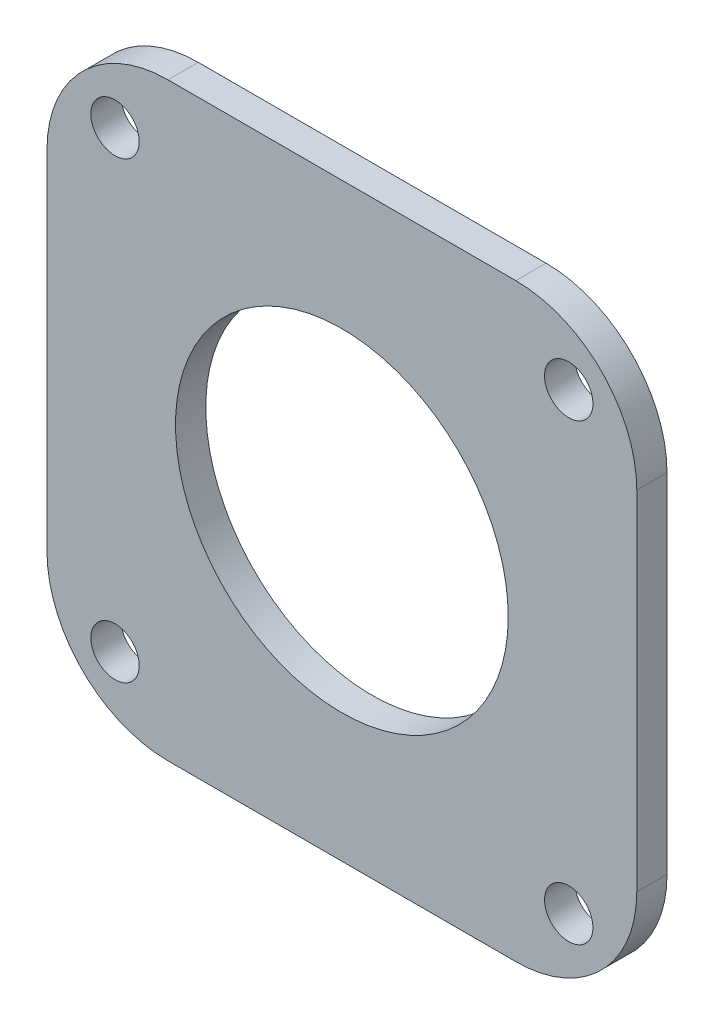
from build123d import *

# Parameters (mm, degrees)
SKETCH_1_R          = 1.6
SKETCH_1_R_2        = 5.5
EXTRUDE_2_DEPTH     = 2
FILLET_6_R          = 8
FILLET_7_R          = 8
FILLET_8_R          = 8
FILLET_9_R          = 8
SKETCH_2_R          = 11
CUT_EXTRUDE_1_DEPTH = 10


with BuildPart() as part:
    # 草图1 → 凸台-拉伸2 (new body)
    # profile 1 of 2: a face of its own
    with BuildSketch(Plane.XY):
        with BuildLine():
            Line((-16.6, 15), (-19.5, 15))
            Line((-19.5, 15), (-19.5, -19.5))
            Line((-19.5, -19.5), (19.5, -19.5))
            Line((19.5, -19.5), (19.5, 19.5))
            Line((19.5, 19.5), (-15, 19.5))
            Line((-15, 19.5), (-15, 16.6))
            ThreePointArc((-15, 16.6), (-13.86862915, 16.13137085), (-13.4, 15))
            ThreePointArc((-13.4, 15), (-15, 13.4), (-16.6, 15))
        make_face()
        with Locations((-15, -15)):
            Circle(SKETCH_1_R, mode=Mode.SUBTRACT)
        with Locations((15, -15)):
            Circle(SKETCH_1_R, mode=Mode.SUBTRACT)
        Circle(SKETCH_1_R_2, mode=Mode.SUBTRACT)
        with Locations((15, 15)):
            Circle(SKETCH_1_R, mode=Mode.SUBTRACT)
    # profile 2 of 2: a face of its own
    with BuildSketch(Plane.XY):
        with BuildLine():
            Line((-19.5, 19.5), (-19.5, 15))
            Line((-19.5, 15), (-16.6, 15))
            ThreePointArc((-16.6, 15), (-16.13137085, 16.13137085), (-15, 16.6))
            Line((-15, 16.6), (-15, 19.5))
            Line((-15, 19.5), (-19.5, 19.5))
        make_face()
    extrude(amount=EXTRUDE_2_DEPTH)

    # 圆角6
    fillet_6_edges = [part.edges().sort_by_distance(p)[0] for p in [
        (-19.5, 19.5, 1),
    ]]
    fillet(fillet_6_edges, radius=FILLET_6_R)

    # 圆角7
    fillet_7_edges = [part.edges().sort_by_distance(p)[0] for p in [
        (19.5, 19.5, 1),
    ]]
    fillet(fillet_7_edges, radius=FILLET_7_R)

    # 圆角8
    fillet_8_edges = [part.edges().sort_by_distance(p)[0] for p in [
        (-19.5, -19.5, 1),
    ]]
    fillet(fillet_8_edges, radius=FILLET_8_R)

    # 圆角9
    fillet_9_edges = [part.edges().sort_by_distance(p)[0] for p in [
        (19.5, -19.5, 1),
    ]]
    fillet(fillet_9_edges, radius=FILLET_9_R)

    # 草图2 → 切除-拉伸1 (cut)
    with BuildSketch(Plane.XY.offset(2)):
        Circle(SKETCH_2_R)
    extrude(amount=-CUT_EXTRUDE_1_DEPTH, mode=Mode.SUBTRACT)


solid = part.part
